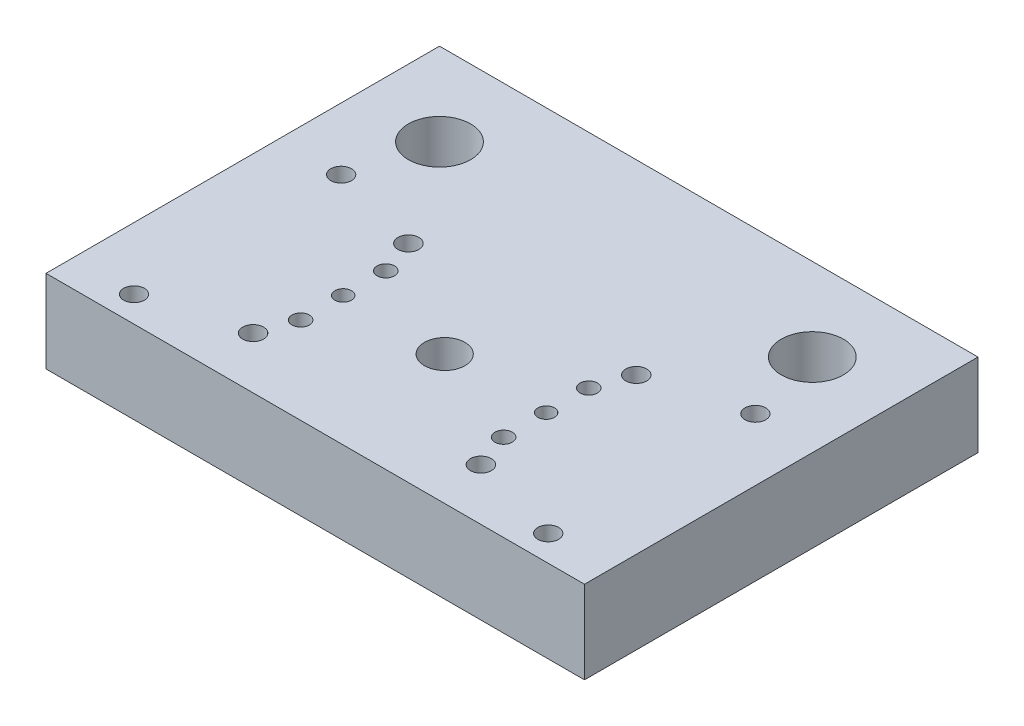
from build123d import *

# Parameters (mm, degrees)
SKETCH1_W                                           = 260
SKETCH1_H                                           = 190
BOSS_EXTRUDE1_DEPTH                                 = 40
SKETCH2_R                                           = 15
CUT_EXTRUDE1_DEPTH                                  = 166.90660023
SKETCH3_R                                           = 5.05
CUT_EXTRUDE2_DEPTH                                  = 166.90660023
SKETCH4_R                                           = 9.770548986
CUT_EXTRUDE3_DEPTH                                  = 166.90660023
CBORE_FOR_M8_HEX_SOCKET_HEAD_CAP_SCREW1_D           = 8.4
CBORE_FOR_M8_HEX_SOCKET_HEAD_CAP_SCREW1_CBORE_D     = 15
CBORE_FOR_M8_HEX_SOCKET_HEAD_CAP_SCREW1_CBORE_DEPTH = 8.6
F_8_0MM_DOWEL_HOLE1_D                               = 8
F_10_0MM_DOWEL_HOLE1_D                              = 10
SKETCH15_R                                          = 8.5
CUT_EXTRUDE4_DEPTH                                  = 31.9


with BuildPart() as part:
    # Sketch1 → Boss-Extrude1 (new body)
    with BuildSketch(Plane(origin=(0, 0, 0), x_dir=(1, 0, 0), z_dir=(0, 1, 0))):
        Rectangle(SKETCH1_W, SKETCH1_H)
    extrude(amount=-BOSS_EXTRUDE1_DEPTH)

    # Sketch2 → Cut-Extrude1 (cut, through all)
    with BuildSketch(Plane(origin=(0, 0, 0), x_dir=(1, 0, 0), z_dir=(0, 1, 0))):
        with Locations(Location((-90, 55, 0), (0, 0, 270))):
            Circle(SKETCH2_R)
        with Locations(Location((90, 55, 0), (0, 0, 270))):
            Circle(SKETCH2_R)
    extrude(amount=-CUT_EXTRUDE1_DEPTH, mode=Mode.SUBTRACT)

    # Sketch3 → Cut-Extrude2 (cut, through all)
    with BuildSketch(Plane.XZ.offset(40)):
        with Locations(Location((-55, 70, 0), (0, 0, 270))):
            Circle(SKETCH3_R)
        with Locations(Location((55, 70, 0), (0, 0, 270))):
            Circle(SKETCH3_R)
        with Locations(Location((55, -5, 0), (0, 0, 270))):
            Circle(SKETCH3_R)
        with Locations(Location((-55, -5, 0), (0, 0, 270))):
            Circle(SKETCH3_R)
    extrude(amount=-CUT_EXTRUDE2_DEPTH, mode=Mode.SUBTRACT)

    # Sketch4 → Cut-Extrude3 (cut, through all)
    with BuildSketch(Plane.XZ.offset(40)):
        with Locations(Location((0, 32.5, 0), (0, 0, 270))):
            Circle(SKETCH4_R)
    extrude(amount=-CUT_EXTRUDE3_DEPTH, mode=Mode.SUBTRACT)

    # CBORE for M8 Hex Socket Head Cap Screw1 (through all)
    with Locations(Plane(origin=(0, -40, 0), x_dir=(-1, 0, 0), z_dir=(0, -1, 0))):
        with Locations((-49, -11.95), (-49, -53.05), (49, -53.05), (49, -11.95)):
            CounterBoreHole(CBORE_FOR_M8_HEX_SOCKET_HEAD_CAP_SCREW1_D / 2, CBORE_FOR_M8_HEX_SOCKET_HEAD_CAP_SCREW1_CBORE_D / 2, CBORE_FOR_M8_HEX_SOCKET_HEAD_CAP_SCREW1_CBORE_DEPTH)

    # Ø8.0mm Dowel Hole1 (through all)
    with Locations(Plane(origin=(0, -40, 0), x_dir=(-1, 0, 0), z_dir=(0, -1, 0))):
        with Locations((-49, -32.5), (49, -32.5)):
            Hole(F_8_0MM_DOWEL_HOLE1_D / 2)

    # Ø10.0mm Dowel Hole1 (through all)
    with Locations(Plane(origin=(0, -40, 0), x_dir=(-1, 0, 0), z_dir=(0, -1, 0))):
        with Locations((-100, 17.5), (-100, -82.5), (100, -82.5), (100, 17.5)):
            Hole(F_10_0MM_DOWEL_HOLE1_D / 2)

    # Sketch15 → Cut-Extrude4 (cut)
    with BuildSketch(Plane.XZ.offset(40)):
        with Locations(Location((-100, 82.5, 0), (0, 0, 270))):
            Circle(SKETCH15_R)
        with Locations(Location((100, 82.5, 0), (0, 0, 270))):
            Circle(SKETCH15_R)
        with Locations(Location((100, -17.5, 0), (0, 0, 270))):
            Circle(SKETCH15_R)
        with Locations(Location((-100, -17.5, 0), (0, 0, 270))):
            Circle(SKETCH15_R)
    extrude(amount=-CUT_EXTRUDE4_DEPTH, mode=Mode.SUBTRACT)


solid = part.part
